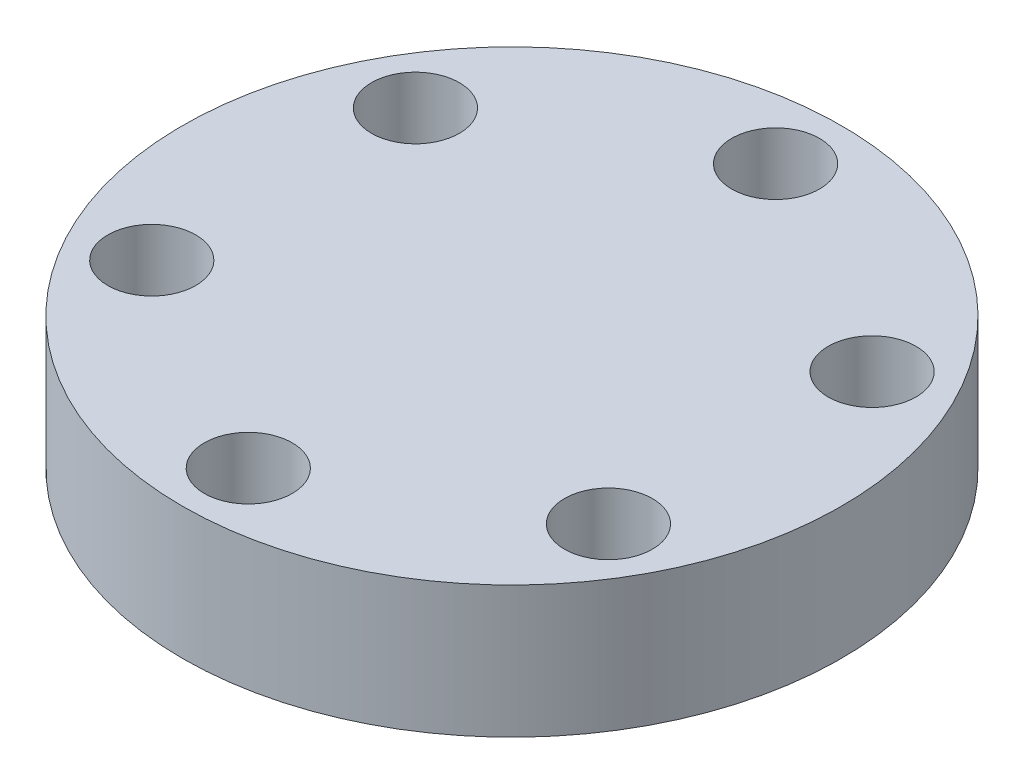
from build123d import *

# Parameters (mm, degrees)
SKETCH1_R             = 15
BOSS_EXTRUDE1_DEPTH   = 30
SKETCH2_R             = 7
BOSS_EXTRUDE2_DEPTH   = 4
F_4_0MM_DOWEL_HOLE1_D = 4
CIRPATTERN1_COUNT     = 6
SKETCH6_R             = 15
SKETCH6_R_2           = 2
BOSS_EXTRUDE3_DEPTH   = 6


with BuildPart() as part:
    # Sketch1 → Boss-Extrude1 (new body)
    with BuildSketch(Plane(origin=(0, 0, 0), x_dir=(1, 0, 0), z_dir=(0, 1, 0))):
        with Locations(Location((0, 0, 0), (0, 0, 270))):
            Circle(SKETCH1_R)
    extrude(amount=BOSS_EXTRUDE1_DEPTH)

    # Sketch2 → Boss-Extrude2 (add)
    with BuildSketch(Plane.XZ):
        with Locations(Location((0, 0, 0), (0, 0, 270))):
            Circle(SKETCH2_R)
    extrude(amount=BOSS_EXTRUDE2_DEPTH)

    # Ø4.0mm Dowel Hole1 (through all)
    with Locations(Plane(origin=(0, 0, 0), x_dir=(-1, 0, 0), z_dir=(0, -1, 0))):
        with Locations((0, -12)):
            f_4_0mm_dowel_hole1 = Hole(F_4_0MM_DOWEL_HOLE1_D / 2)

    # CirPattern1: Ø4.0mm Dowel Hole1 ×6 about axis
    cirpattern1_axis = Axis((0, 0, 0), (0, 1, 0))
    for i in range(1, CIRPATTERN1_COUNT):
        add(f_4_0mm_dowel_hole1.rotate(cirpattern1_axis, i * 360 / CIRPATTERN1_COUNT), mode=Mode.SUBTRACT)


with BuildPart() as body_2:
    # Sketch6 → Boss-Extrude3 (new body)
    with BuildSketch(Plane(origin=(0, 30, 0), x_dir=(1, 0, 0), z_dir=(0, 1, 0))):
        with Locations(Location((0, 0, 0), (0, 0, 270))):
            Circle(SKETCH6_R)
        with Locations(Location((-10.392304845, 6, 0), (0, 0, 270))):
            Circle(SKETCH6_R_2, mode=Mode.SUBTRACT)
        with Locations(Location((-10.392304845, -6, 0), (0, 0, 270))):
            Circle(SKETCH6_R_2, mode=Mode.SUBTRACT)
        with Locations(Location((0, -12, 0), (0, 0, 270))):
            Circle(SKETCH6_R_2, mode=Mode.SUBTRACT)
        with Locations(Location((10.392304845, -6, 0), (0, 0, 270))):
            Circle(SKETCH6_R_2, mode=Mode.SUBTRACT)
        with Locations(Location((10.392304845, 6, 0), (0, 0, 270))):
            Circle(SKETCH6_R_2, mode=Mode.SUBTRACT)
        with Locations(Location((0, 12, 0), (0, 0, 270))):
            Circle(SKETCH6_R_2, mode=Mode.SUBTRACT)
    extrude(amount=BOSS_EXTRUDE3_DEPTH)


solid = body_2.part
